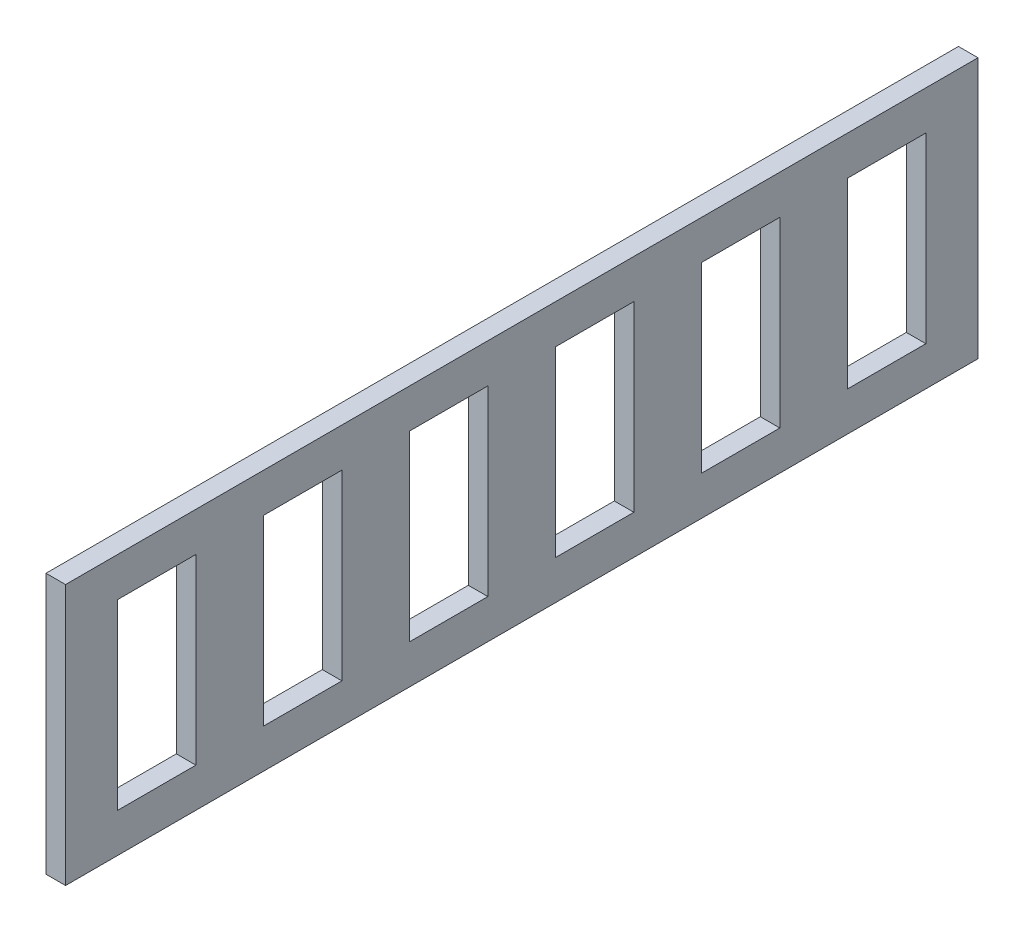
from build123d import *

# Parameters (mm, degrees)
SKETCH1_W           = 700
SKETCH1_H           = 200
SKETCH1_W_2         = 60
SKETCH1_H_2         = 140
BOSS_EXTRUDE1_DEPTH = 15


with BuildPart() as part:
    # Sketch1 → Boss-Extrude1 (new body)
    with BuildSketch(Plane(origin=(0, 0, 0), x_dir=(0, 0, -1), z_dir=(1, 0, 0))):
        with Locations((0, 100)):
            Rectangle(SKETCH1_W, SKETCH1_H)
        with Locations((-280, 100)):
            Rectangle(SKETCH1_W_2, SKETCH1_H_2, mode=Mode.SUBTRACT)
        with Locations((-168, 100)):
            Rectangle(SKETCH1_W_2, SKETCH1_H_2, mode=Mode.SUBTRACT)
        with Locations((-56, 100)):
            Rectangle(SKETCH1_W_2, SKETCH1_H_2, mode=Mode.SUBTRACT)
        with Locations((56, 100)):
            Rectangle(SKETCH1_W_2, SKETCH1_H_2, mode=Mode.SUBTRACT)
        with Locations((168, 100)):
            Rectangle(SKETCH1_W_2, SKETCH1_H_2, mode=Mode.SUBTRACT)
        with Locations((280, 100)):
            Rectangle(SKETCH1_W_2, SKETCH1_H_2, mode=Mode.SUBTRACT)
    extrude(amount=BOSS_EXTRUDE1_DEPTH)


solid = part.part
